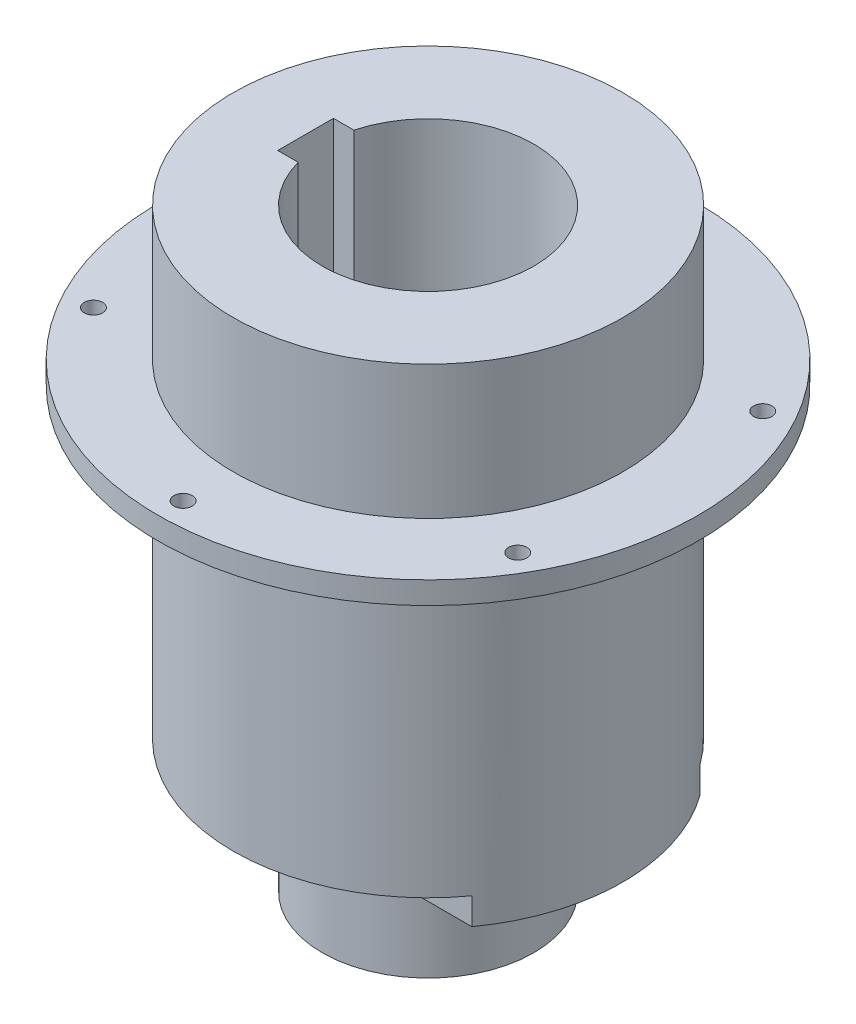
from build123d import *

# Parameters (mm, degrees)
EXTRUDE1_REACH            = 119.713
SKETCH2_W                 = 8
SKETCH2_H                 = 10
SKETCH3_W                 = 13.5
SKETCH3_H                 = 4
SKETCH5_W                 = 15.5
SKETCH5_H                 = 4.8
EXTRUDE3_DEPTH            = 40
SKETCH6_R                 = 1.65
EXTRUDE4_DEPTH            = 10
M8X1_0_TAPPED_HOLE1_D     = 7
M8X1_0_TAPPED_HOLE1_DEPTH = 20
M8X1_0_TAPPED_HOLE1_TIP   = 2.103012167
M6X1_0_TAPPED_HOLE1_D     = 5
M6X1_0_TAPPED_HOLE1_DEPTH = 26.5


with BuildPart() as part:
    # Sketch1 → Revolve1 (revolve)
    with BuildSketch(Plane.XY, mode=Mode.PRIVATE) as revolve1_sk:
        Polygon((-6.5, 26.3), (-19, 26.3), (-19, 106.8), (-35, 106.8), (-35, 19), (-19, 19), (-19, 0), (-10, 0), (-10, 15), (-6.5, 15), align=None)
    revolve(revolve1_sk.sketch.rotate(Axis((0, 0, 0), (0, 1, 0)), 270), axis=Axis((0, 0, 0), (0, 1, 0)))

    # Sketch2 → Extrude1 (cut, up to next)
    with BuildSketch(Plane(origin=(0, 106.8, 0), x_dir=(1, 0, 0), z_dir=(0, 1, 0)), mode=Mode.PRIVATE) as extrude1_sk1:
        with Locations((-18, 0)):
            Rectangle(SKETCH2_W, SKETCH2_H)
    extrude1_tool1 = extrude(extrude1_sk1.sketch, amount=-EXTRUDE1_REACH, mode=Mode.PRIVATE) & part.part
    add(extrude1_tool1.solids().sort_by_distance((-18, 106.8, 0))[0], mode=Mode.SUBTRACT)

    # Sketch3 → Revolve2 (revolve)
    with BuildSketch(Plane.XY, mode=Mode.PRIVATE) as revolve2_sk:
        with Locations((-41.75, 80.8)):
            Rectangle(SKETCH3_W, SKETCH3_H)
    revolve(revolve2_sk.sketch.rotate(Axis((0, 0, 0), (0, 1, 0)), 270), axis=Axis((0, 0, 0), (0, 1, 0)))

    # Sketch5 → Extrude3 (cut, symmetric)
    with BuildSketch(Plane(origin=(0, 0, 0), x_dir=(0, 0, -1), z_dir=(1, 0, 0))):
        with Locations((28.25, 21.4)):
            Rectangle(SKETCH5_W, SKETCH5_H)
        with Locations((-28.25, 21.4)):
            Rectangle(SKETCH5_W, SKETCH5_H)
    extrude(amount=EXTRUDE3_DEPTH, both=True, mode=Mode.SUBTRACT)

    # Sketch6 → Extrude4 (cut)
    with BuildSketch(Plane(origin=(0, 82.8, 0), x_dir=(1, 0, 0), z_dir=(0, 1, 0))):
        with Locations(Location((0, -44, 0), (0, 0, 270))):
            Circle(SKETCH6_R)
        with Locations(Location((-38.105117767, -22, 0), (0, 0, 270))):
            Circle(SKETCH6_R)
        with Locations(Location((-38.105117767, 22, 0), (0, 0, 270))):
            Circle(SKETCH6_R)
        with Locations(Location((0, 44, 0), (0, 0, 270))):
            Circle(SKETCH6_R)
        with Locations(Location((38.105117767, 22, 0), (0, 0, 270))):
            Circle(SKETCH6_R)
        with Locations(Location((38.105117767, -22, 0), (0, 0, 270))):
            Circle(SKETCH6_R)
    extrude(amount=-EXTRUDE4_DEPTH, mode=Mode.SUBTRACT)

    # M8x1.0 Tapped Hole1
    with Locations(Plane(origin=(-35, 19, 0), x_dir=(-1, 0, 0), z_dir=(0, -1, 0))):
        with Locations((-62.5, 0), (-7.5, 0), (-35, 27.5), (-35, -27.5)):
            Hole(M8X1_0_TAPPED_HOLE1_D / 2, depth=M8X1_0_TAPPED_HOLE1_DEPTH)
            with Locations((0, 0, -(M8X1_0_TAPPED_HOLE1_DEPTH + M8X1_0_TAPPED_HOLE1_TIP / 2))):  # 118° drill point
                Cone(0, M8X1_0_TAPPED_HOLE1_D / 2, M8X1_0_TAPPED_HOLE1_TIP, mode=Mode.SUBTRACT)

    # M6x1.0 Tapped Hole1
    with Locations(Plane(origin=(-22, 0, 0), x_dir=(0, 0, -1), z_dir=(1, 0, 0))):
        with Locations((0, 56.8)):
            Hole(M6X1_0_TAPPED_HOLE1_D / 2, depth=M6X1_0_TAPPED_HOLE1_DEPTH)


solid = part.part
